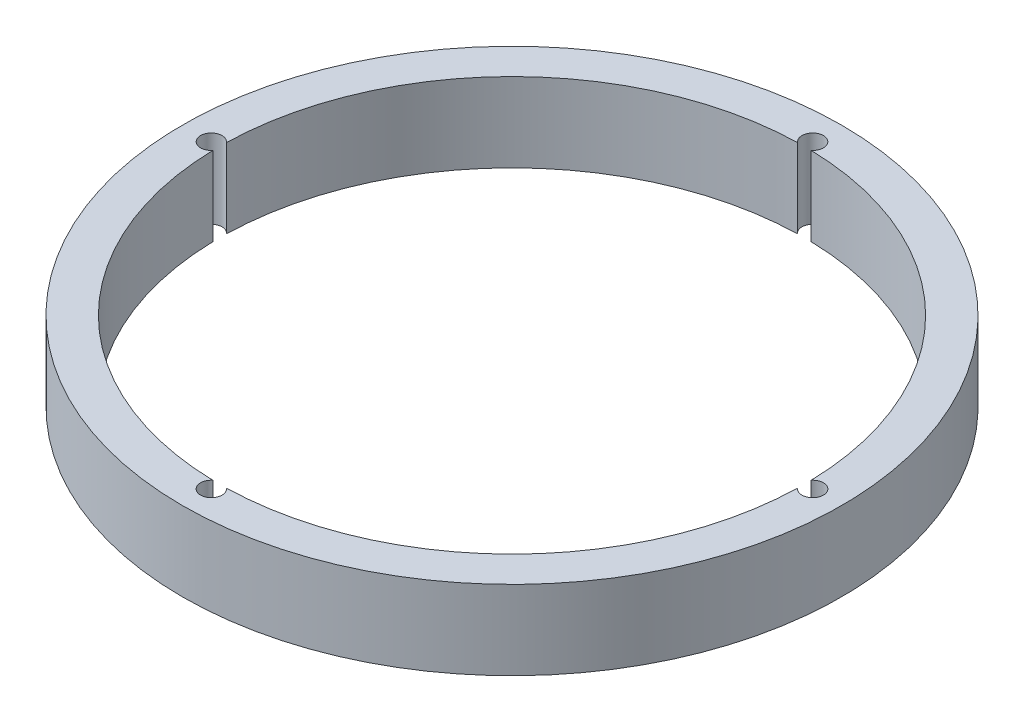
from build123d import *

# Parameters (mm, degrees)
SKETCH1_R           = 80
BOSS_EXTRUDE1_DEPTH = 19.2


with BuildPart() as part:
    # Sketch1 → Boss-Extrude1 (new body)
    with BuildSketch(Plane(origin=(0, 0, 0), x_dir=(1, 0, 0), z_dir=(0, 1, 0))):
        with Locations(Location((0, 0, 0), (0, 0, 270))):
            Circle(SKETCH1_R)
        with BuildLine():
            ThreePointArc((1.638299788, 70.98109589), (0, 75.6), (-1.638299788, 70.98109589))
            ThreePointArc((-1.638299788, 70.98109589), (-50.204581464, 50.204581464), (-70.98109589, 1.638299788))
            ThreePointArc((-70.98109589, 1.638299788), (-75.6, 0), (-70.98109589, -1.638299788))
            ThreePointArc((-70.98109589, -1.638299788), (-50.204581464, -50.204581464), (-1.638299788, -70.98109589))
            ThreePointArc((-1.638299788, -70.98109589), (0, -75.6), (1.638299788, -70.98109589))
            ThreePointArc((1.638299788, -70.98109589), (50.204581464, -50.204581464), (70.98109589, -1.638299788))
            ThreePointArc((70.98109589, -1.638299788), (75.6, 0), (70.98109589, 1.638299788))
            ThreePointArc((70.98109589, 1.638299788), (50.204581464, 50.204581464), (1.638299788, 70.98109589))
        make_face(mode=Mode.SUBTRACT)
    extrude(amount=BOSS_EXTRUDE1_DEPTH)


solid = part.part
